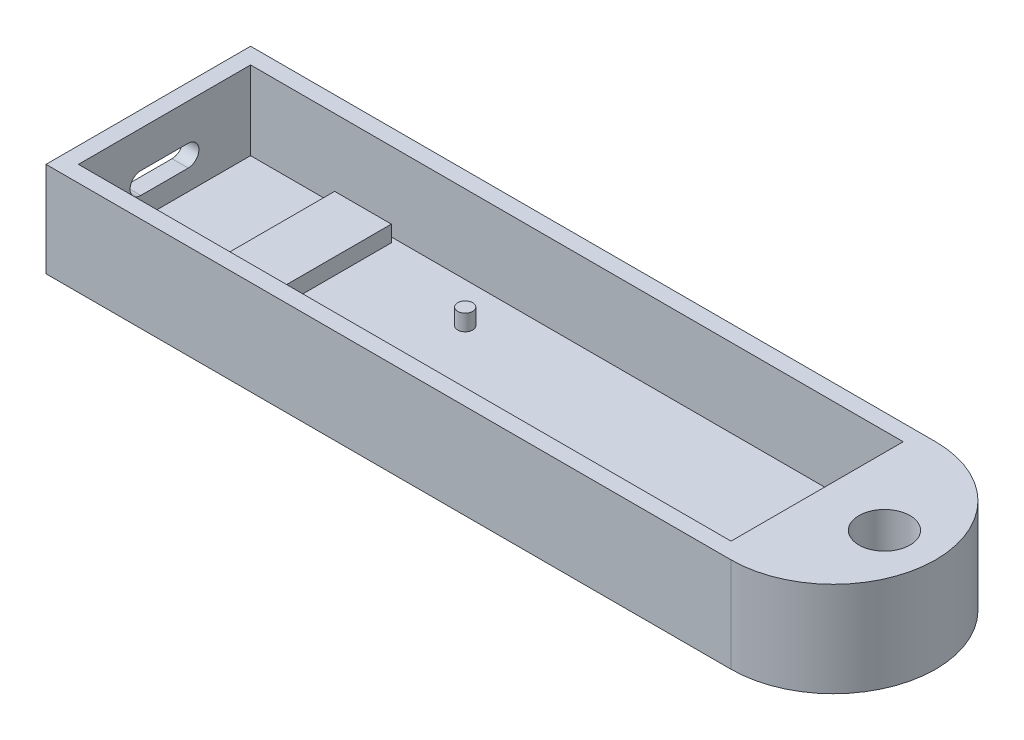
from build123d import *

# Parameters (mm, degrees)
SKETCH1_W           = 7
SKETCH1_H           = 20
BOSS_EXTRUDE2_DEPTH = 4
SKETCH1_4_W         = 80.55
SKETCH1_4_H         = 21.25
SKETCH1_4_R         = 0.925
SKETCH1_4_W_2       = 7
SKETCH1_4_H_2       = 20
BOSS_EXTRUDE3_DEPTH = 2
SKETCH1_5_R         = 0.925
BOSS_EXTRUDE4_DEPTH = 4
SKETCH1_6_W         = 80.55
SKETCH1_6_H         = 21.25
SKETCH1_6_R         = 3.155
BOSS_EXTRUDE5_DEPTH = 11.7
CUT_EXTRUDE1_DEPTH  = 4.85


with BuildPart() as part:
    # Sketch1 → Boss-Extrude2 (new body)
    with BuildSketch(Plane(origin=(0, 0, 0), x_dir=(1, 0, 0), z_dir=(0, 1, 0))):
        with Locations((-33.759922188, -0.124838084)):
            Rectangle(SKETCH1_W, SKETCH1_H)
    extrude(amount=BOSS_EXTRUDE2_DEPTH)

    # Sketch1<4> → Boss-Extrude3 (add)
    with BuildSketch(Plane(origin=(0, 0, 0), x_dir=(1, 0, 0), z_dir=(0, 1, 0))):
        with Locations((-7.984922188, -0.124838084)):
            Rectangle(SKETCH1_4_W, SKETCH1_4_H)
        with Locations((-16.839922188, -7.381359305)):
            Circle(SKETCH1_4_R, mode=Mode.SUBTRACT)
        with Locations((-33.759922188, -0.124838084)):
            Rectangle(SKETCH1_4_W_2, SKETCH1_4_H_2, mode=Mode.SUBTRACT)
        with Locations((-16.839922188, 5.570161916)):
            Circle(SKETCH1_4_R, mode=Mode.SUBTRACT)
        with Locations((30.160077812, 5.570161916)):
            Circle(SKETCH1_4_R, mode=Mode.SUBTRACT)
        with Locations((30.160077812, -7.381359305)):
            Circle(SKETCH1_4_R, mode=Mode.SUBTRACT)
    extrude(amount=BOSS_EXTRUDE3_DEPTH)

    # Sketch1<5> → Boss-Extrude4 (add)
    with BuildSketch(Plane(origin=(0, 0, 0), x_dir=(1, 0, 0), z_dir=(0, 1, 0))):
        with Locations((-16.839922188, 5.570161916)):
            Circle(SKETCH1_5_R)
        with Locations((-16.839922188, -7.381359305)):
            Circle(SKETCH1_5_R)
        with Locations((30.160077812, -7.381359305)):
            Circle(SKETCH1_5_R)
        with Locations((30.160077812, 5.570161916)):
            Circle(SKETCH1_5_R)
    extrude(amount=BOSS_EXTRUDE4_DEPTH)

    # Sketch1<6> → Boss-Extrude5 (add)
    with BuildSketch(Plane(origin=(0, 0, 0), x_dir=(1, 0, 0), z_dir=(0, 1, 0))):
        with BuildLine():
            Line((34.290077812, 12.500161916), (-50.259922188, 12.500161916))
            Line((-50.259922188, 12.500161916), (-50.259922188, -12.749838084))
            Line((-50.259922188, -12.749838084), (34.290077812, -12.749838084))
            ThreePointArc((34.290077812, -12.749838084), (46.915077812, -0.124838084), (34.290077812, 12.500161916))
        make_face()
        with Locations((-7.984922188, -0.124838084)):
            Rectangle(SKETCH1_6_W, SKETCH1_6_H, mode=Mode.SUBTRACT)
        with Locations((40.600077812, -0.124838084)):
            Circle(SKETCH1_6_R, mode=Mode.SUBTRACT)
    extrude(amount=BOSS_EXTRUDE5_DEPTH)

    # Sketch3 → Cut-Extrude1 (cut, symmetric)
    with BuildSketch(Plane.ZY.offset(50.259922188)):
        with BuildLine():
            Line((-2.800161916, 7.175), (3.049838084, 7.175))
            ThreePointArc((3.049838084, 7.175), (4.374838084, 5.85), (3.049838084, 4.525))
            Line((3.049838084, 4.525), (-2.800161916, 4.525))
            ThreePointArc((-2.800161916, 4.525), (-4.125161916, 5.85), (-2.800161916, 7.175))
        make_face()
    extrude(amount=CUT_EXTRUDE1_DEPTH, both=True, mode=Mode.SUBTRACT)


solid = part.part
